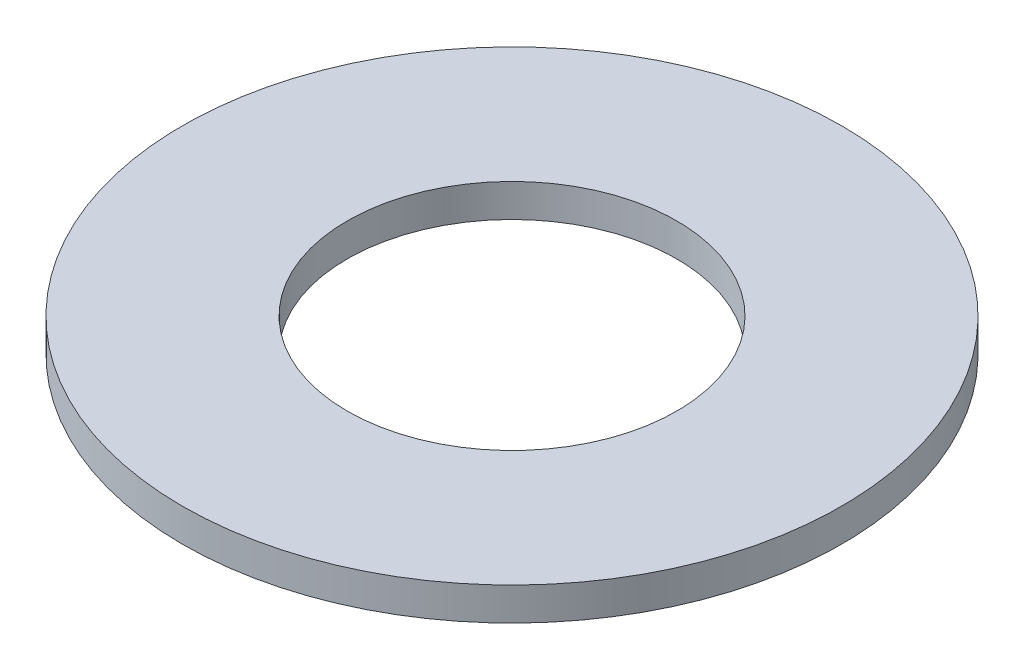
from build123d import *

# Parameters (mm, degrees)
SKETCH1_R           = 2
SKETCH1_R_2         = 1
BOSS_EXTRUDE1_DEPTH = 0.2


with BuildPart() as part:
    # Sketch1 → Boss-Extrude1 (new body)
    with BuildSketch(Plane(origin=(0, 0, 0), x_dir=(1, 0, 0), z_dir=(0, 1, 0))):
        with Locations(Location((0, 0, 0), (0, 0, 270))):
            Circle(SKETCH1_R)
        with Locations(Location((0, 0, 0), (0, 0, 270))):
            Circle(SKETCH1_R_2, mode=Mode.SUBTRACT)
    extrude(amount=BOSS_EXTRUDE1_DEPTH)


solid = part.part
